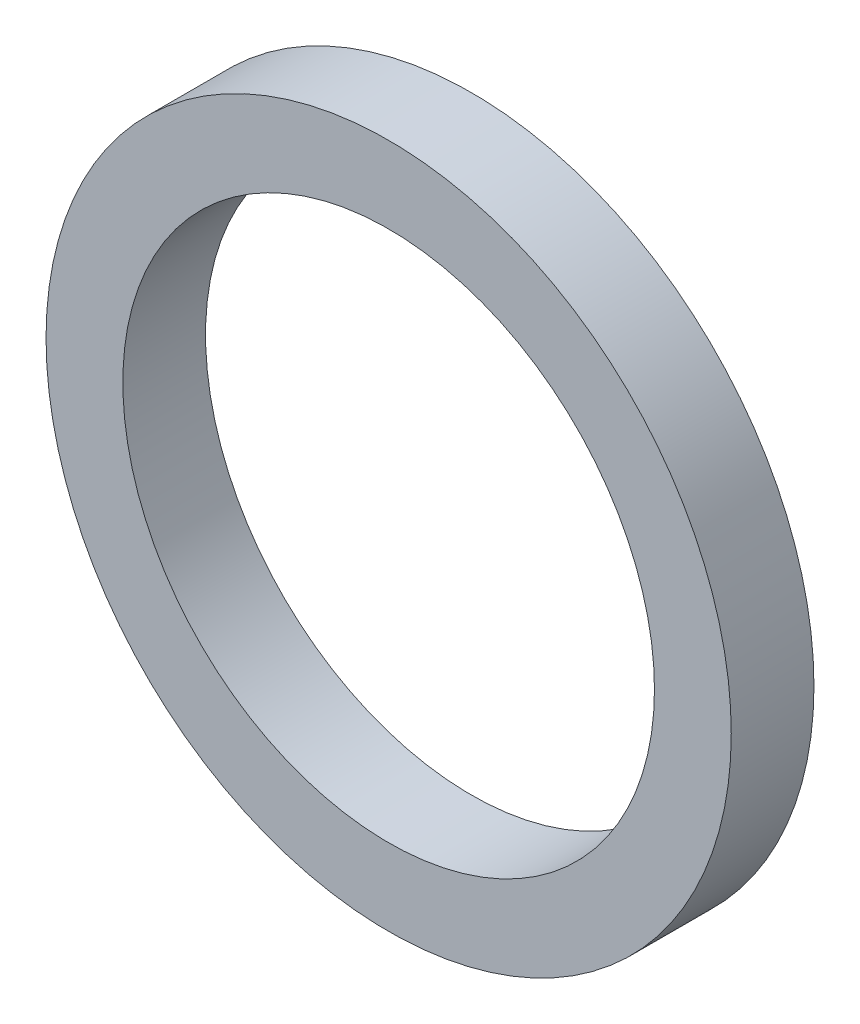
from build123d import *

# Parameters (mm, degrees)
SKIZZE1_R                       = 29
SKIZZE1_R_2                     = 22.5
AUFSATZ_LINEAR_AUSTRAGEN1_DEPTH = 7


with BuildPart() as part:
    # Skizze1 → Aufsatz-Linear austragen1 (new body)
    with BuildSketch(Plane.XY):
        Circle(SKIZZE1_R)
        Circle(SKIZZE1_R_2, mode=Mode.SUBTRACT)
    extrude(amount=AUFSATZ_LINEAR_AUSTRAGEN1_DEPTH)


solid = part.part
